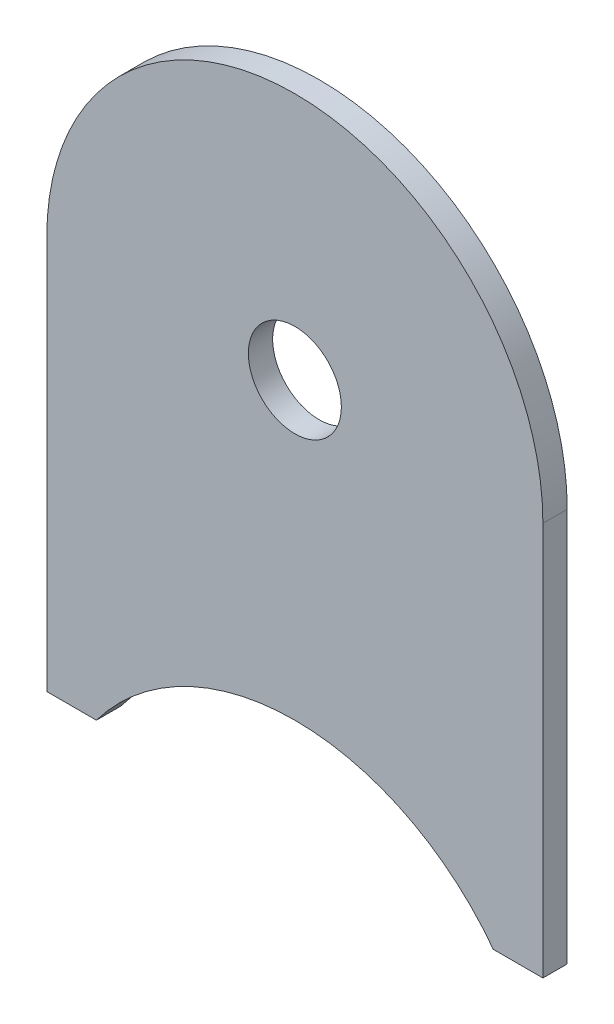
from build123d import *

# Parameters (mm, degrees)
SKETCH1_R           = 2.38125
BOSS_EXTRUDE1_DEPTH = 1.2446


with BuildPart() as part:
    # Sketch1 → Boss-Extrude1 (new body)
    with BuildSketch(Plane.XY):
        with BuildLine():
            Line((0, 0), (2.54, 0))
            ThreePointArc((2.54, 0), (12.7, 5.08), (22.86, 0))
            Line((22.86, 0), (25.4, 0))
            Line((25.4, 0), (25.4, 20.16125))
            ThreePointArc((25.4, 20.16125), (12.7, 32.86125), (0, 20.16125))
            Line((0, 20.16125), (0, 0))
        make_face()
        with Locations((12.7, 20.16125)):
            Circle(SKETCH1_R, mode=Mode.SUBTRACT)
    extrude(amount=BOSS_EXTRUDE1_DEPTH)


solid = part.part
